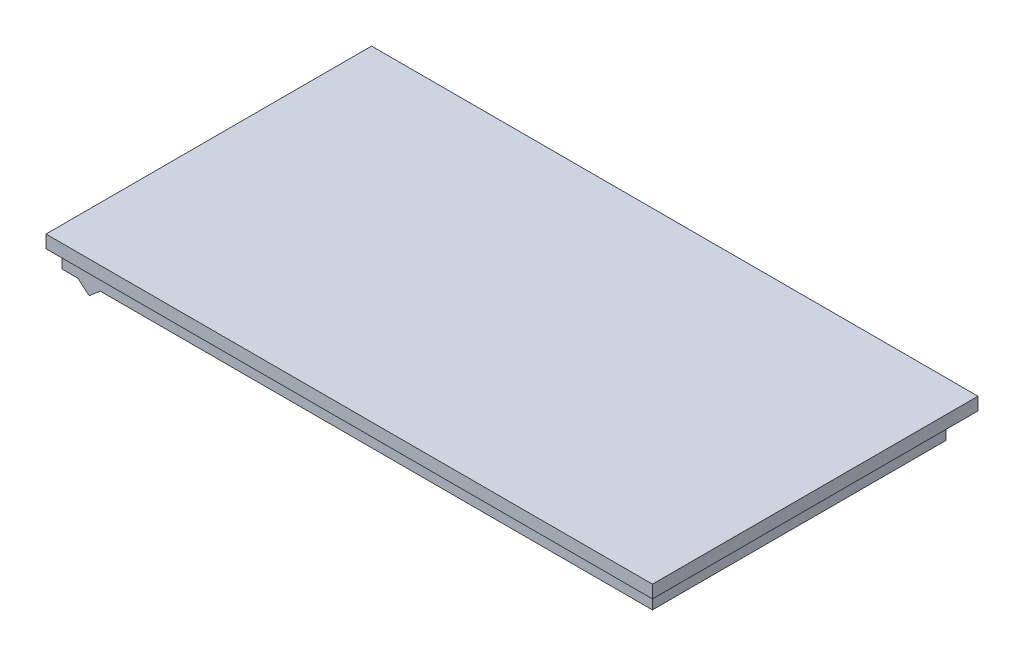
from build123d import *

# Parameters (mm, degrees)
ESBO_O1_W                = 95
ESBO_O1_H                = 51
RESSALTO_EXTRUS_O1_DEPTH = 2
ESBO_O3_W                = 90
ESBO_O3_H                = 2
RESSALTO_EXTRUS_O3_DEPTH = 2
ESBO_O5_W                = 90
ESBO_O5_H                = 2
RESSALTO_EXTRUS_O4_DEPTH = 2
ESBO_O6_W                = 2
ESBO_O6_H                = 42
RESSALTO_EXTRUS_O5_DEPTH = 4
ESBO_O7_W                = 90
ESBO_O7_H                = 4
RESSALTO_EXTRUS_O6_DEPTH = 2
ESBO_O8_W                = 46
ESBO_O8_H                = 4
RESSALTO_EXTRUS_O7_DEPTH = 2.5
ESBO_O10_W               = 3.5
ESBO_O10_H               = 4
RESSALTO_EXTRUS_O8_DEPTH = 1.5
CORTE_EXTRUS_O1_DEPTH    = 52.5
CORTE_EXTRUS_O2_DEPTH    = 62.5


with BuildPart() as part:
    # Esboço1 → Ressalto-extrusão1 (new body)
    with BuildSketch(Plane(origin=(0, 0, 0), x_dir=(1, 0, 0), z_dir=(0, 1, 0))):
        with Locations((47.5, 25.5)):
            Rectangle(ESBO_O1_W, ESBO_O1_H)
    extrude(amount=RESSALTO_EXTRUS_O1_DEPTH)

    # Esboço3 → Ressalto-extrusão3 (add)
    with BuildSketch(Plane(origin=(0, 0, 0), x_dir=(-1, 0, 0), z_dir=(0, -1, 0))):
        with Locations((-47.5, 5.5)):
            Rectangle(ESBO_O3_W, ESBO_O3_H)
    extrude(amount=RESSALTO_EXTRUS_O3_DEPTH)

    # Esboço5 → Ressalto-extrusão4 (add)
    with BuildSketch(Plane.XZ):
        with Locations((47.5, -45.5)):
            Rectangle(ESBO_O5_W, ESBO_O5_H)
    extrude(amount=RESSALTO_EXTRUS_O4_DEPTH)

    # Esboço6 → Ressalto-extrusão5 (add)
    with BuildSketch(Plane.XZ):
        with Locations((91.5, -25.5)):
            Rectangle(ESBO_O6_W, ESBO_O6_H)
    extrude(amount=RESSALTO_EXTRUS_O5_DEPTH)

    # Esboço7 → Ressalto-extrusão6 (add)
    with BuildSketch(Plane(origin=(0, -2, 0), x_dir=(-1, 0, 0), z_dir=(0, -1, 0))):
        with Locations((-47.5, 4.5)):
            Rectangle(ESBO_O7_W, ESBO_O7_H)
        with Locations((-47.5, 46.5)):
            Rectangle(ESBO_O7_W, ESBO_O7_H)
    extrude(amount=RESSALTO_EXTRUS_O6_DEPTH)

    # Esboço8 → Ressalto-extrusão7 (add)
    with BuildSketch(Plane.ZY):
        with Locations((-25.5, -2)):
            Rectangle(ESBO_O8_W, ESBO_O8_H)
    extrude(amount=-RESSALTO_EXTRUS_O7_DEPTH)

    # Esboço10 → Ressalto-extrusão8 (add)
    with BuildSketch(Plane.XZ.offset(4)):
        with Locations((4.25, -4.5)):
            Rectangle(ESBO_O10_W, ESBO_O10_H)
        with Locations((4.25, -46.5)):
            Rectangle(ESBO_O10_W, ESBO_O10_H)
    extrude(amount=RESSALTO_EXTRUS_O8_DEPTH)

    # Esboço12 → Corte-extrusão1 (cut)
    with BuildSketch(Plane.XY.offset(-2.5)):
        Polygon((2.5, -4), (4.25, -5.5), (2.5, -5.5), align=None)
    extrude(amount=-CORTE_EXTRUS_O1_DEPTH, mode=Mode.SUBTRACT)

    # Esboço13 → Corte-extrusão2 (cut)
    with BuildSketch(Plane.XY.offset(-2.5)):
        Polygon((4.25, -5.5), (6, -4), (6, -5.5), align=None)
    extrude(amount=-CORTE_EXTRUS_O2_DEPTH, mode=Mode.SUBTRACT)


solid = part.part
